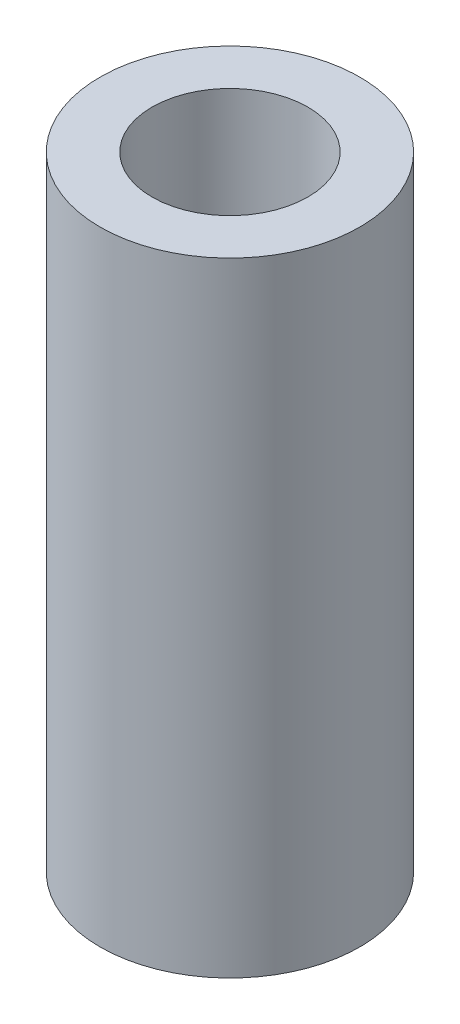
from build123d import *

# Parameters (mm, degrees)
SKETCH1_R           = 2.5
SKETCH1_R_2         = 1.5
BOSS_EXTRUDE1_DEPTH = 12


with BuildPart() as part:
    # Sketch1 → Boss-Extrude1 (new body)
    with BuildSketch(Plane(origin=(0, 0, 0), x_dir=(1, 0, 0), z_dir=(0, 1, 0))):
        with Locations(Location((0, 0, 0), (0, 0, 270))):
            Circle(SKETCH1_R)
        with Locations(Location((0, 0, 0), (0, 0, 270))):
            Circle(SKETCH1_R_2, mode=Mode.SUBTRACT)
    extrude(amount=BOSS_EXTRUDE1_DEPTH)


solid = part.part
